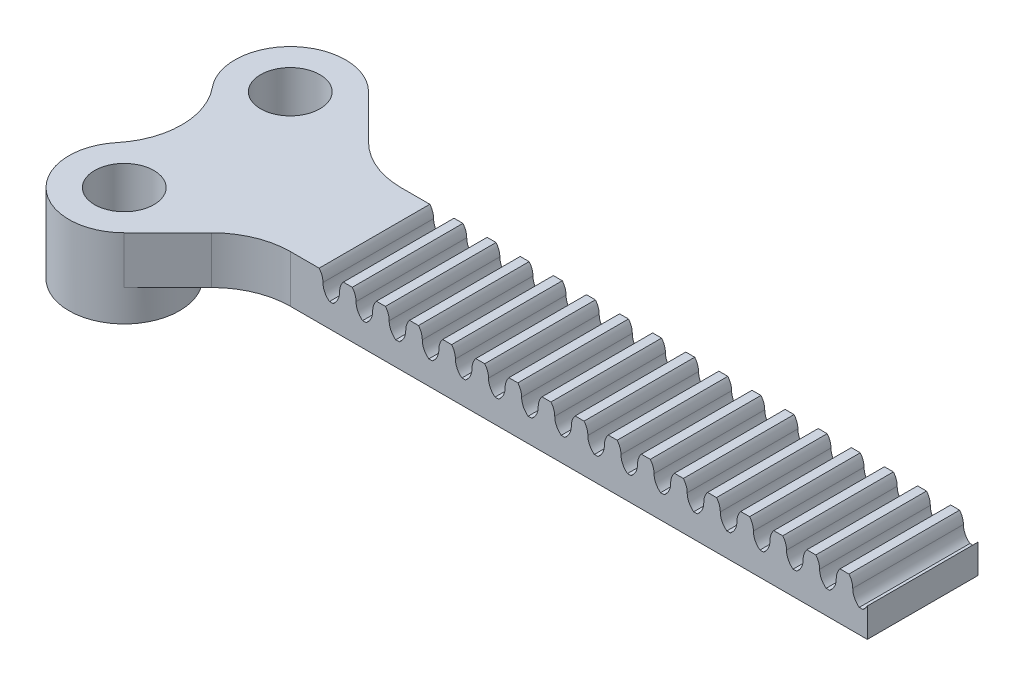
from build123d import *

# Parameters (mm, degrees)
SALIENTE_EXTRUIR1_DEPTH = 6
CROQUIS18_R             = 3.75
CORTAR_EXTRUIR2_DEPTH   = 100.239609028
CORTAR_EXTRUIR3_DEPTH   = 101.709979645
CROQUIS21_R             = 7
CROQUIS21_R_2           = 3.75
SALIENTE_EXTRUIR3_DEPTH = 4


with BuildPart() as part:
    # Croquis14 → Saliente-Extruir1 (new body)
    with BuildSketch(Plane(origin=(0, 0, 0), x_dir=(1, 0, 0), z_dir=(0, 1, 0))):
        with BuildLine():
            Line((0, 7), (-72.95836944, 7))
            ThreePointArc((-72.95836944, 7), (-76.785203763, 7.761204675), (-80.029437252, 9.928932188))
            Line((-80.029437252, 9.928932188), (-85.550252532, 15.449747468))
            ThreePointArc((-85.550252532, 15.449747468), (-95.206682203, 15.681422839), (-95.901175207, 6.047213638))
            ThreePointArc((-95.901175207, 6.047213638), (-93.729852734, 0), (-95.901175207, -6.047213638))
            ThreePointArc((-95.901175207, -6.047213638), (-95.206682203, -15.681422839), (-85.550252532, -15.449747468))
            Line((-85.550252532, -15.449747468), (-80.029437252, -9.928932188))
            ThreePointArc((-80.029437252, -9.928932188), (-76.785203763, -7.761204675), (-72.95836944, -7))
            Line((-72.95836944, -7), (0, -7))
            Line((0, -7), (0, 7))
        make_face()
    extrude(amount=SALIENTE_EXTRUIR1_DEPTH)

    # Croquis18 → Cortar-Extruir2 (cut, through all)
    with BuildSketch(Plane(origin=(0, 6, 0), x_dir=(1, 0, 0), z_dir=(0, 1, 0))):
        with Locations(Location((-90.5, -10.5, 0), (0, 0, 270))):
            Circle(CROQUIS18_R)
        with Locations(Location((-90.5, 10.5, 0), (0, 0, 90))):
            Circle(CROQUIS18_R)
    extrude(amount=-CORTAR_EXTRUIR2_DEPTH, mode=Mode.SUBTRACT)

    # Croquis16 → Cortar-Extruir3 (cut, through all)
    with BuildSketch(Plane.XY.offset(7)):
        with BuildLine():
            Line((-63.851106218, 2.999108248), (-63.400446165, 2.999108248))
            ThreePointArc((-63.400446165, 2.999108248), (-62.793533932, 3.736620744), (-62.576232944, 4.6667))
            ThreePointArc((-62.576232944, 4.6667), (-62.453168135, 5.374868347), (-62.098403746, 6))
            Line((-62.098403746, 6), (-65.15454931, 6))
            ThreePointArc((-65.15454931, 6), (-64.798764982, 5.375104926), (-64.67531944, 4.6667))
            ThreePointArc((-64.67531944, 4.6667), (-64.458018451, 3.736620744), (-63.851106218, 2.999108248))
        make_face()
        with BuildLine():
            Line((-59.662406218, 2.999108248), (-59.211746165, 2.999108248))
            ThreePointArc((-59.211746165, 2.999108248), (-58.604833932, 3.736620744), (-58.387532944, 4.6667))
            ThreePointArc((-58.387532944, 4.6667), (-58.264468135, 5.374868347), (-57.909703746, 6))
            Line((-57.909703746, 6), (-60.96584931, 6))
            ThreePointArc((-60.96584931, 6), (-60.610064982, 5.375104926), (-60.48661944, 4.6667))
            ThreePointArc((-60.48661944, 4.6667), (-60.269318451, 3.736620744), (-59.662406218, 2.999108248))
        make_face()
        with BuildLine():
            Line((-68.039806218, 2.999108248), (-67.589146165, 2.999108248))
            ThreePointArc((-67.589146165, 2.999108248), (-66.982233932, 3.736620744), (-66.764932944, 4.6667))
            ThreePointArc((-66.764932944, 4.6667), (-66.641868135, 5.374868347), (-66.287103746, 6))
            Line((-66.287103746, 6), (-69.34324931, 6))
            ThreePointArc((-69.34324931, 6), (-68.987464982, 5.375104926), (-68.86401944, 4.6667))
            ThreePointArc((-68.86401944, 4.6667), (-68.646718451, 3.736620744), (-68.039806218, 2.999108248))
        make_face()
        with BuildLine():
            Line((-55.473706218, 2.999108248), (-55.023046165, 2.999108248))
            ThreePointArc((-55.023046165, 2.999108248), (-54.416133932, 3.736620744), (-54.198832944, 4.6667))
            ThreePointArc((-54.198832944, 4.6667), (-54.075768135, 5.374868347), (-53.721003746, 6))
            Line((-53.721003746, 6), (-56.77714931, 6))
            ThreePointArc((-56.77714931, 6), (-56.421364982, 5.375104926), (-56.29791944, 4.6667))
            ThreePointArc((-56.29791944, 4.6667), (-56.080618451, 3.736620744), (-55.473706218, 2.999108248))
        make_face()
        with BuildLine():
            Line((-51.285006218, 2.999108248), (-50.834346165, 2.999108248))
            ThreePointArc((-50.834346165, 2.999108248), (-50.227433932, 3.736620744), (-50.010132944, 4.6667))
            ThreePointArc((-50.010132944, 4.6667), (-49.887068135, 5.374868347), (-49.532303746, 6))
            Line((-49.532303746, 6), (-52.58844931, 6))
            ThreePointArc((-52.58844931, 6), (-52.232664982, 5.375104926), (-52.10921944, 4.6667))
            ThreePointArc((-52.10921944, 4.6667), (-51.891918451, 3.736620744), (-51.285006218, 2.999108248))
        make_face()
        with BuildLine():
            Line((-47.096306218, 2.999108248), (-46.645646165, 2.999108248))
            ThreePointArc((-46.645646165, 2.999108248), (-46.038733932, 3.736620744), (-45.821432944, 4.6667))
            ThreePointArc((-45.821432944, 4.6667), (-45.698368135, 5.374868347), (-45.343603746, 6))
            Line((-45.343603746, 6), (-48.39974931, 6))
            ThreePointArc((-48.39974931, 6), (-48.043964982, 5.375104926), (-47.92051944, 4.6667))
            ThreePointArc((-47.92051944, 4.6667), (-47.703218451, 3.736620744), (-47.096306218, 2.999108248))
        make_face()
        with BuildLine():
            Line((-42.907606218, 2.999108248), (-42.456946165, 2.999108248))
            ThreePointArc((-42.456946165, 2.999108248), (-41.850033932, 3.736620744), (-41.632732944, 4.6667))
            ThreePointArc((-41.632732944, 4.6667), (-41.509668135, 5.374868347), (-41.154903746, 6))
            Line((-41.154903746, 6), (-44.21104931, 6))
            ThreePointArc((-44.21104931, 6), (-43.855264982, 5.375104926), (-43.73181944, 4.6667))
            ThreePointArc((-43.73181944, 4.6667), (-43.514518451, 3.736620744), (-42.907606218, 2.999108248))
        make_face()
        with BuildLine():
            Line((-38.718906218, 2.999108248), (-38.268246165, 2.999108248))
            ThreePointArc((-38.268246165, 2.999108248), (-37.661333932, 3.736620744), (-37.444032944, 4.6667))
            ThreePointArc((-37.444032944, 4.6667), (-37.320968135, 5.374868347), (-36.966203746, 6))
            Line((-36.966203746, 6), (-40.02234931, 6))
            ThreePointArc((-40.02234931, 6), (-39.666564982, 5.375104926), (-39.54311944, 4.6667))
            ThreePointArc((-39.54311944, 4.6667), (-39.325818451, 3.736620744), (-38.718906218, 2.999108248))
        make_face()
        with BuildLine():
            Line((-34.530206218, 2.999108248), (-34.079546165, 2.999108248))
            ThreePointArc((-34.079546165, 2.999108248), (-33.472633932, 3.736620744), (-33.255332944, 4.6667))
            ThreePointArc((-33.255332944, 4.6667), (-33.132268135, 5.374868347), (-32.777503746, 6))
            Line((-32.777503746, 6), (-35.83364931, 6))
            ThreePointArc((-35.83364931, 6), (-35.477864982, 5.375104926), (-35.35441944, 4.6667))
            ThreePointArc((-35.35441944, 4.6667), (-35.137118451, 3.736620744), (-34.530206218, 2.999108248))
        make_face()
        with BuildLine():
            Line((-30.341506218, 2.999108248), (-29.890846165, 2.999108248))
            ThreePointArc((-29.890846165, 2.999108248), (-29.283933932, 3.736620744), (-29.066632944, 4.6667))
            ThreePointArc((-29.066632944, 4.6667), (-28.943568135, 5.374868347), (-28.588803746, 6))
            Line((-28.588803746, 6), (-31.64494931, 6))
            ThreePointArc((-31.64494931, 6), (-31.289164982, 5.375104926), (-31.16571944, 4.6667))
            ThreePointArc((-31.16571944, 4.6667), (-30.948418451, 3.736620744), (-30.341506218, 2.999108248))
        make_face()
        with BuildLine():
            Line((-26.152806218, 2.999108248), (-25.702146165, 2.999108248))
            ThreePointArc((-25.702146165, 2.999108248), (-25.095233932, 3.736620744), (-24.877932944, 4.6667))
            ThreePointArc((-24.877932944, 4.6667), (-24.754868135, 5.374868347), (-24.400103746, 6))
            Line((-24.400103746, 6), (-27.45624931, 6))
            ThreePointArc((-27.45624931, 6), (-27.100464982, 5.375104926), (-26.97701944, 4.6667))
            ThreePointArc((-26.97701944, 4.6667), (-26.759718451, 3.736620744), (-26.152806218, 2.999108248))
        make_face()
        with BuildLine():
            Line((-21.964106218, 2.999108248), (-21.513446165, 2.999108248))
            ThreePointArc((-21.513446165, 2.999108248), (-20.906533932, 3.736620744), (-20.689232944, 4.6667))
            ThreePointArc((-20.689232944, 4.6667), (-20.566168135, 5.374868347), (-20.211403746, 6))
            Line((-20.211403746, 6), (-23.26754931, 6))
            ThreePointArc((-23.26754931, 6), (-22.911764982, 5.375104926), (-22.78831944, 4.6667))
            ThreePointArc((-22.78831944, 4.6667), (-22.571018451, 3.736620744), (-21.964106218, 2.999108248))
        make_face()
        with BuildLine():
            Line((-17.775406218, 2.999108248), (-17.324746165, 2.999108248))
            ThreePointArc((-17.324746165, 2.999108248), (-16.717833932, 3.736620744), (-16.500532944, 4.6667))
            ThreePointArc((-16.500532944, 4.6667), (-16.377468135, 5.374868347), (-16.022703746, 6))
            Line((-16.022703746, 6), (-19.07884931, 6))
            ThreePointArc((-19.07884931, 6), (-18.723064982, 5.375104926), (-18.59961944, 4.6667))
            ThreePointArc((-18.59961944, 4.6667), (-18.382318451, 3.736620744), (-17.775406218, 2.999108248))
        make_face()
        with BuildLine():
            Line((-13.586706218, 2.999108248), (-13.136046165, 2.999108248))
            ThreePointArc((-13.136046165, 2.999108248), (-12.529133932, 3.736620744), (-12.311832944, 4.6667))
            ThreePointArc((-12.311832944, 4.6667), (-12.188768135, 5.374868347), (-11.834003746, 6))
            Line((-11.834003746, 6), (-14.89014931, 6))
            ThreePointArc((-14.89014931, 6), (-14.534364982, 5.375104926), (-14.41091944, 4.6667))
            ThreePointArc((-14.41091944, 4.6667), (-14.193618451, 3.736620744), (-13.586706218, 2.999108248))
        make_face()
        with BuildLine():
            Line((-9.398006218, 2.999108248), (-8.947346165, 2.999108248))
            ThreePointArc((-8.947346165, 2.999108248), (-8.340433932, 3.736620744), (-8.123132944, 4.6667))
            ThreePointArc((-8.123132944, 4.6667), (-8.000068135, 5.374868347), (-7.645303746, 6))
            Line((-7.645303746, 6), (-10.70144931, 6))
            ThreePointArc((-10.70144931, 6), (-10.345664982, 5.375104926), (-10.22221944, 4.6667))
            ThreePointArc((-10.22221944, 4.6667), (-10.004918451, 3.736620744), (-9.398006218, 2.999108248))
        make_face()
        with BuildLine():
            Line((-5.209306218, 2.999108248), (-4.758646165, 2.999108248))
            ThreePointArc((-4.758646165, 2.999108248), (-4.151733932, 3.736620744), (-3.934432944, 4.6667))
            ThreePointArc((-3.934432944, 4.6667), (-3.811368135, 5.374868347), (-3.456603746, 6))
            Line((-3.456603746, 6), (-6.51274931, 6))
            ThreePointArc((-6.51274931, 6), (-6.156964982, 5.375104926), (-6.03351944, 4.6667))
            ThreePointArc((-6.03351944, 4.6667), (-5.816218451, 3.736620744), (-5.209306218, 2.999108248))
        make_face()
        with BuildLine():
            Line((-1.020606218, 2.999108248), (-0.569946165, 2.999108248))
            ThreePointArc((-0.569946165, 2.999108248), (0.036966068, 3.736620744), (0.254267056, 4.6667))
            ThreePointArc((0.254267056, 4.6667), (0.377331865, 5.374868347), (0.732096254, 6))
            Line((0.732096254, 6), (-2.32404931, 6))
            ThreePointArc((-2.32404931, 6), (-1.968264982, 5.375104926), (-1.84481944, 4.6667))
            ThreePointArc((-1.84481944, 4.6667), (-1.627518451, 3.736620744), (-1.020606218, 2.999108248))
        make_face()
    extrude(amount=-CORTAR_EXTRUIR3_DEPTH, mode=Mode.SUBTRACT)

    # Croquis21 → Saliente-Extruir3 (add)
    # profile 1 of 2: a face of its own
    with BuildSketch(Plane.XZ):
        with Locations(Location((-90.5, -10.5, 0), (0, 0, 270))):
            Circle(CROQUIS21_R)
        with Locations(Location((-90.5, -10.5, 0), (0, 0, 270))):
            Circle(CROQUIS21_R_2, mode=Mode.SUBTRACT)
    # profile 2 of 2: a face of its own
    with BuildSketch(Plane.XZ):
        with Locations(Location((-90.5, 10.5, 0), (0, 0, 219.502533363))):
            Circle(CROQUIS21_R)
        with Locations(Location((-90.5, 10.5, 0), (0, 0, 90))):
            Circle(CROQUIS21_R_2, mode=Mode.SUBTRACT)
    extrude(amount=SALIENTE_EXTRUIR3_DEPTH)


solid = part.part
